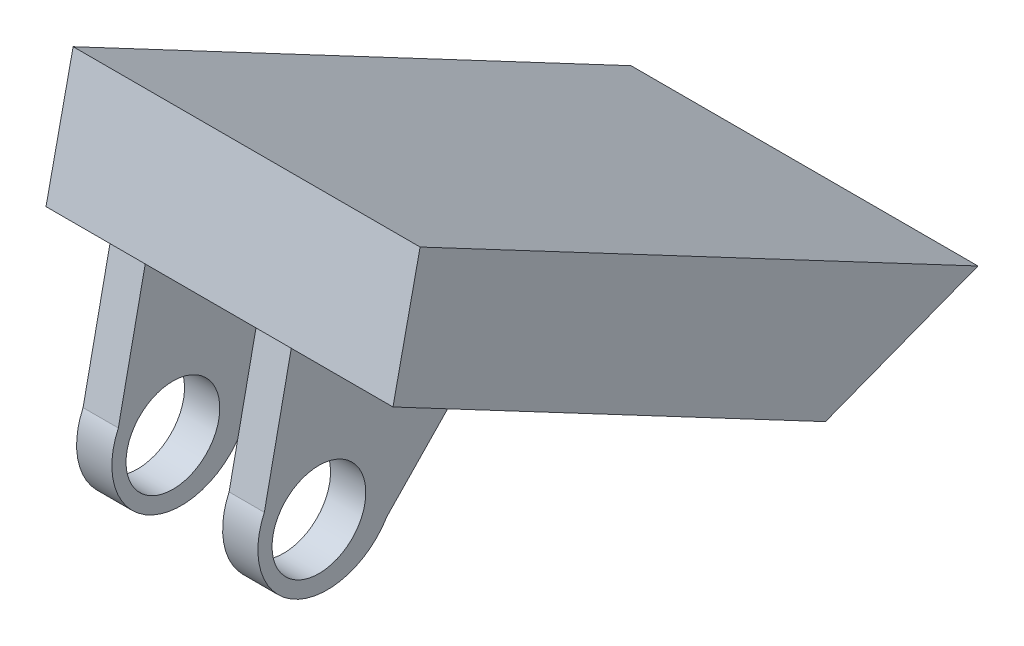
from build123d import *

# Parameters (mm, degrees)
BOSS_EXTRUDE1_DEPTH = 59.94146
SKETCH2_R           = 8.099936755
BOSS_EXTRUDE2_DEPTH = 6.09219
BOSS_EXTRUDE3_START = 25.228296
SKETCH2_2_R         = 8.099936755
BOSS_EXTRUDE3_DEPTH = 6.09219


with BuildPart() as part:
    # Sketch1 → Boss-Extrude1 (new body)
    with BuildSketch(Plane(origin=(80.083152, 0, 0), x_dir=(0, 0, -1), z_dir=(1, 0, 0))):
        Polygon((267.4874, 138.173968), (272.174462, 159.761428), (368.557048, 108.729526), (342.20531, 98.6155), align=None)
    extrude(amount=BOSS_EXTRUDE1_DEPTH)

    # Sketch2 → Boss-Extrude2 (add)
    with BuildSketch(Plane(origin=(87.778844, 0, 0), x_dir=(0, 0, -1), z_dir=(1, 0, 0))):
        with BuildLine():
            Line((271.238218, 136.721088), (266.19327, 112.593374))
            ThreePointArc((266.19327, 112.593374), (271.461683784, 96.939756218), (287.369758, 101.381052))
            Line((287.369758, 101.381052), (304.489612, 119.115332))
            Line((304.489612, 119.115332), (271.238218, 136.721088))
        make_face()
        with Locations(Location((275.620988, 106.805984, 0), (0, 0, 180))):
            Circle(SKETCH2_R, mode=Mode.SUBTRACT)
    extrude(amount=BOSS_EXTRUDE2_DEPTH)

    # Sketch2<2> → Boss-Extrude3 (add)
    with BuildSketch(Plane(origin=(87.778844, 0, 0), x_dir=(0, 0, -1), z_dir=(1, 0, 0)).offset(BOSS_EXTRUDE3_START)):
        with BuildLine():
            Line((271.238218, 136.721088), (266.19327, 112.593374))
            ThreePointArc((266.19327, 112.593374), (271.461683784, 96.939756218), (287.369758, 101.381052))
            Line((287.369758, 101.381052), (304.489612, 119.115332))
            Line((304.489612, 119.115332), (271.238218, 136.721088))
        make_face()
        with Locations(Location((275.620988, 106.805984, 0), (0, 0, 180))):
            Circle(SKETCH2_2_R, mode=Mode.SUBTRACT)
    extrude(amount=BOSS_EXTRUDE3_DEPTH)


solid = part.part
